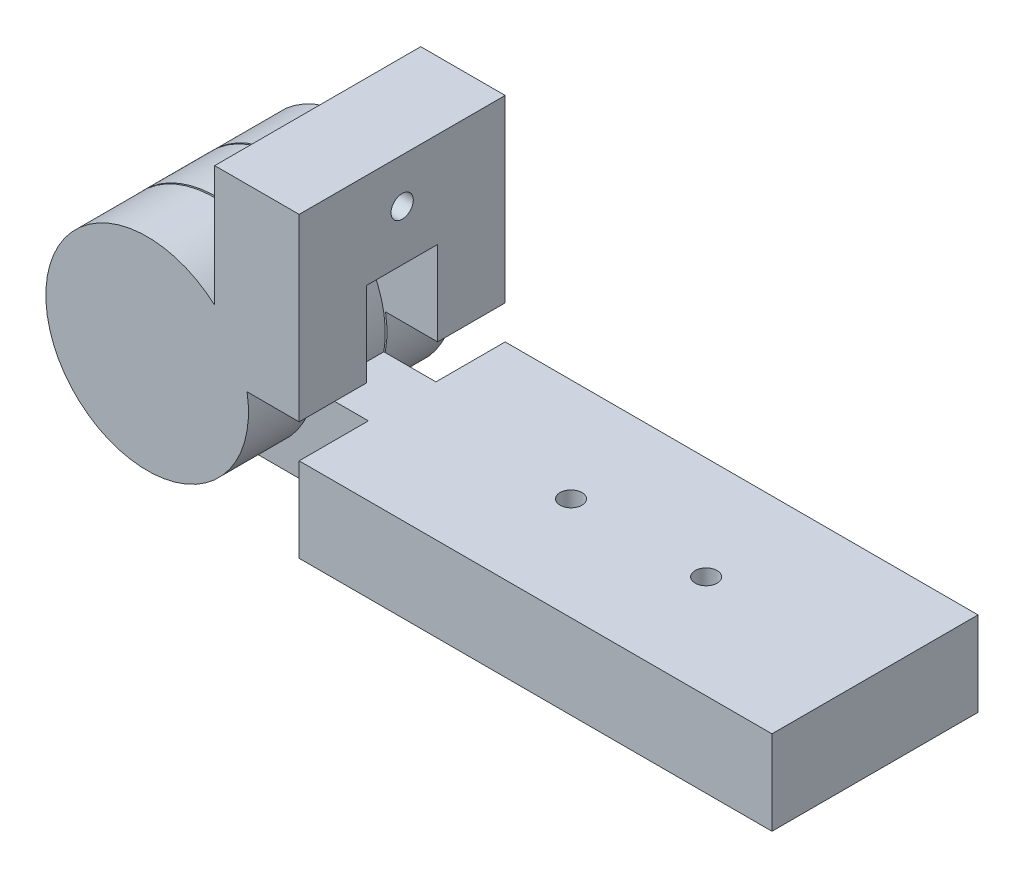
from build123d import *

# Parameters (mm, degrees)
SKETCH1_R           = 19.05
BOSS_EXTRUDE1_DEPTH = 6.35
BOSS_EXTRUDE2_DEPTH = 12.7
SKETCH3_R           = 6.35
CUT_EXTRUDE1_DEPTH  = 111.807045128
SKETCH4_R           = 5.715
BOSS_EXTRUDE3_DEPTH = 6.6675
BOSS_EXTRUDE4_START = 12.7
SKETCH5_R           = 19.05
BOSS_EXTRUDE4_DEPTH = 12.7
BOSS_EXTRUDE5_DEPTH = 12.7
BOSS_EXTRUDE6_REACH = 115.114
SKETCH7_W           = 15.875
SKETCH7_H           = 60.325
BOSS_EXTRUDE7_START = -25.7175
SKETCH8_W           = 88.9
SKETCH8_H           = 15.875
BOSS_EXTRUDE7_DEPTH = 38.735
SKETCH16_R          = 2.0955
CUT_EXTRUDE8_DEPTH  = 123.441848672
SKETCH17_R          = 2.06375
CUT_EXTRUDE9_DEPTH  = 126.16951778
SKETCH20_W          = 38.735
SKETCH20_H          = 42.418
CUT_EXTRUDE13_DEPTH = 123.441848672


with BuildPart() as part:
    # Sketch1 → Boss-Extrude1 (new, symmetric)
    with BuildSketch(Plane.XY):
        with Locations((-73.025, -41.275)):
            Circle(SKETCH1_R)
    extrude(amount=BOSS_EXTRUDE1_DEPTH, both=True)

    # Sketch2 → Boss-Extrude2 (add)
    with BuildSketch(Plane.XY.offset(6.35)):
        with BuildLine():
            Line((-54.241446689, -44.45), (44.45, -44.45))
            Line((44.45, -44.45), (44.45, -60.325))
            Line((44.45, -60.325), (-73.025, -60.325))
            ThreePointArc((-73.025, -60.325), (-60.728277876, -55.824677831), (-54.241446689, -44.45))
        make_face()
    extrude(amount=-BOSS_EXTRUDE2_DEPTH)

    # Sketch3 → Cut-Extrude1 (cut, through all)
    with BuildSketch(Plane.XY.offset(6.35)):
        with Locations((-73.025, -41.275)):
            Circle(SKETCH3_R)
    extrude(amount=-CUT_EXTRUDE1_DEPTH, mode=Mode.SUBTRACT)

    # Sketch8 → Boss-Extrude7 (add)
    with BuildSketch(Plane.XY.offset(6.35).offset(BOSS_EXTRUDE7_START)):
        with Locations((0, -52.3875)):
            Rectangle(SKETCH8_W, SKETCH8_H)
    extrude(amount=BOSS_EXTRUDE7_DEPTH)

    # Sketch17 → Cut-Extrude9 (cut, through all)
    with BuildSketch(Plane(origin=(0, -44.45, 0), x_dir=(1, 0, 0), z_dir=(0, 1, 0))):
        with Locations(Location((-12.7, 0, 0), (0, 0, 180))):
            Circle(SKETCH17_R)
        with Locations(Location((12.7, 0, 0), (0, 0, 180))):
            Circle(SKETCH17_R)
    extrude(amount=-CUT_EXTRUDE9_DEPTH, mode=Mode.SUBTRACT)


with BuildPart() as body_2:
    # Sketch4 → Boss-Extrude3 (new, symmetric)
    with BuildSketch(Plane.XY):
        with Locations((-73.025, -41.275)):
            Circle(SKETCH4_R)
    extrude(amount=BOSS_EXTRUDE3_DEPTH, both=True)

    # Sketch5 → Boss-Extrude4 (add)
    with BuildSketch(Plane.XY.offset(6.6675).offset(BOSS_EXTRUDE4_START)):
        with Locations((-73.025, -41.275)):
            Circle(SKETCH5_R)
    boss_extrude4 = extrude(amount=-BOSS_EXTRUDE4_DEPTH)

    # Sketch6 → Boss-Extrude5 (add)
    with BuildSketch(Plane.XY.offset(19.3675)):
        with BuildLine():
            Line((-44.45, -38.1), (-44.45, 38.1))
            Line((-44.45, 38.1), (-60.325, 38.1))
            Line((-60.325, 38.1), (-60.325, -27.075968343))
            ThreePointArc((-60.325, -27.075968343), (-56.346095636, -32.070835224), (-54.241446689, -38.1))
            Line((-54.241446689, -38.1), (-44.45, -38.1))
        make_face()
    boss_extrude5 = extrude(amount=-BOSS_EXTRUDE5_DEPTH)

    # Mirror1: Boss-Extrude4, Boss-Extrude5 across plane
    add(boss_extrude4.mirror(Plane.XY))
    add(boss_extrude5.mirror(Plane.XY))

    # Sketch7 → Boss-Extrude6 (add, up to next)
    with BuildSketch(Plane(origin=(0, 0, 6.6675), x_dir=(-1, 0, 0), z_dir=(0, 0, -1)), mode=Mode.PRIVATE) as boss_extrude6_sk1:
        with Locations((52.3875, 7.9375)):
            Rectangle(SKETCH7_W, SKETCH7_H)
    boss_extrude6_tool1 = extrude(boss_extrude6_sk1.sketch, amount=BOSS_EXTRUDE6_REACH, mode=Mode.PRIVATE) - body_2.part
    add(boss_extrude6_tool1.solids().sort_by_distance((-52.3875, 7.9375, 6.6675))[0])

    # Sketch16 → Cut-Extrude8 (cut, through all)
    with BuildSketch(Plane.ZY.offset(60.325)):
        with Locations(Location((0, 12.7, 0), (0, 0, 270))):
            Circle(SKETCH16_R)
        with Locations(Location((0, -12.7, 0), (0, 0, 270))):
            Circle(SKETCH16_R)
    extrude(amount=-CUT_EXTRUDE8_DEPTH, mode=Mode.SUBTRACT)

    # Sketch20 → Cut-Extrude13 (cut, through all)
    with BuildSketch(Plane.ZY.offset(60.325)):
        with Locations((0, 16.891)):
            Rectangle(SKETCH20_W, SKETCH20_H)
    extrude(amount=-CUT_EXTRUDE13_DEPTH, mode=Mode.SUBTRACT)


solid = Compound([part.part, body_2.part])
